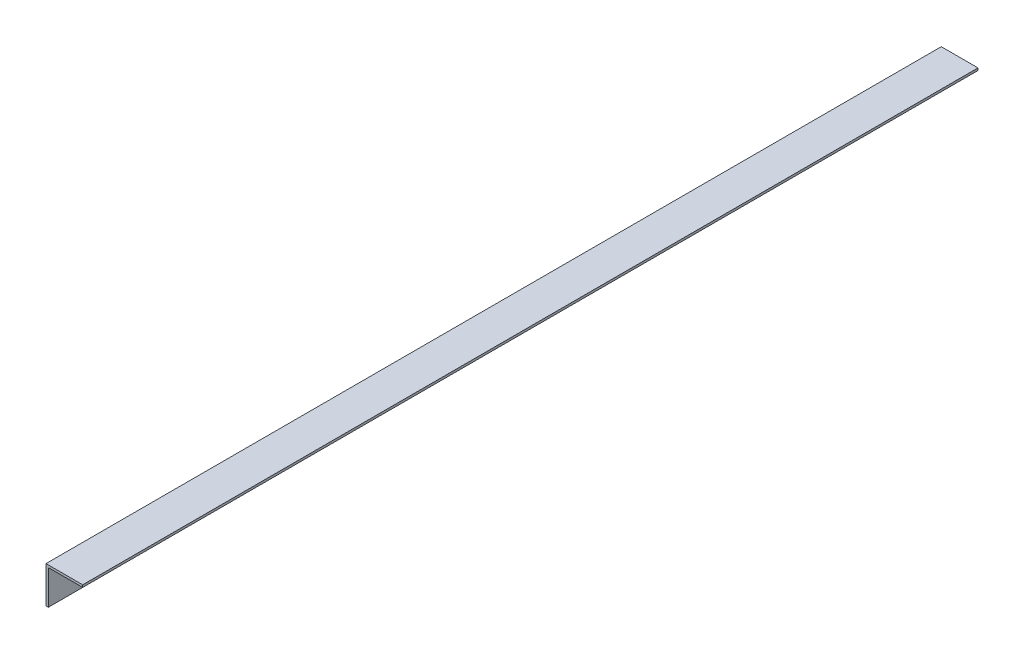
from build123d import *

# Parameters (mm, degrees)
PRESS_UC_RAFI_KOSEBENT_SOL_1_START = -20
PRESS_UC_RAFI_KOSEBENT_SOL_1_DEPTH = 780


with BuildPart() as part:
    # Sketch1 → PRESS_uc_rafi_kosebent_sol_1 (new body)
    with BuildSketch(Plane.XY.offset(PRESS_UC_RAFI_KOSEBENT_SOL_1_START)):
        Polygon((38, 1122), (40, 1122), (40, 1152), (70, 1152), (70, 1154), (38, 1154), align=None)
    extrude(amount=-PRESS_UC_RAFI_KOSEBENT_SOL_1_DEPTH)


solid = part.part
